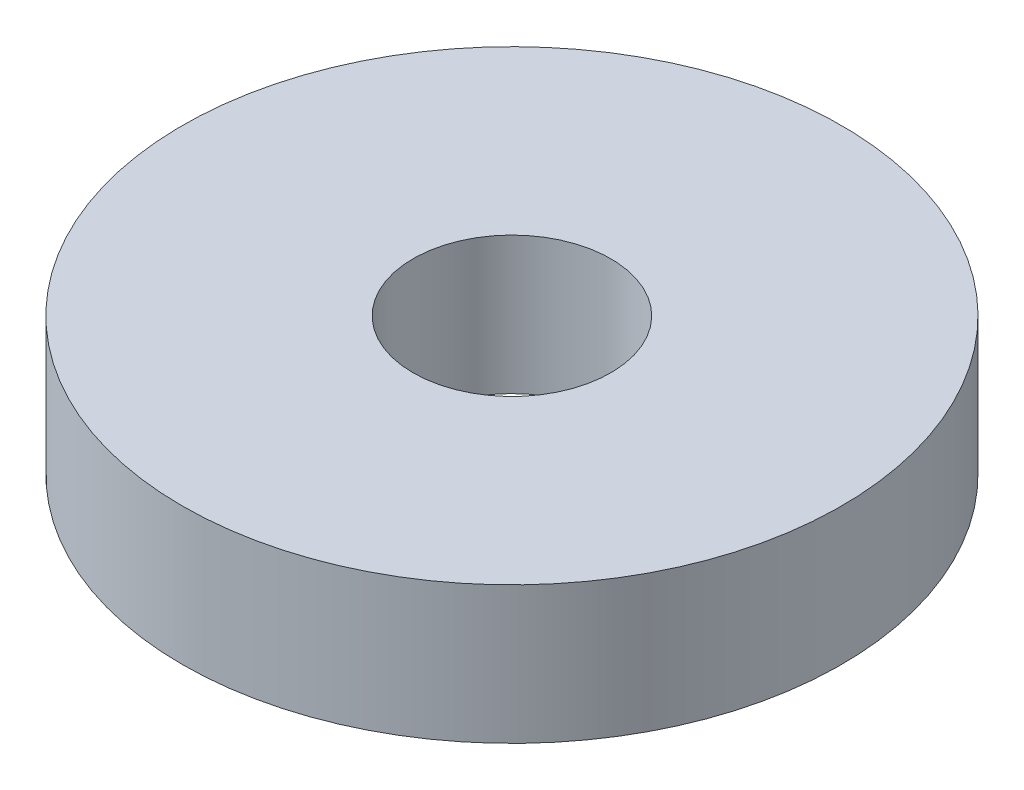
from build123d import *

# Parameters (mm, degrees)
SKETCH_1_R      = 6
SKETCH_1_R_2    = 1.8
EXTRUDE_1_DEPTH = 2.5


with BuildPart() as part:
    # 草图1 → 凸台-拉伸1 (new body)
    with BuildSketch(Plane(origin=(0, 0, 0), x_dir=(1, 0, 0), z_dir=(0, 1, 0))):
        with Locations(Location((0, 0, 0), (0, 0, 270))):
            Circle(SKETCH_1_R)
        with Locations(Location((0, 0, 0), (0, 0, 270))):
            Circle(SKETCH_1_R_2, mode=Mode.SUBTRACT)
    extrude(amount=EXTRUDE_1_DEPTH)


solid = part.part
